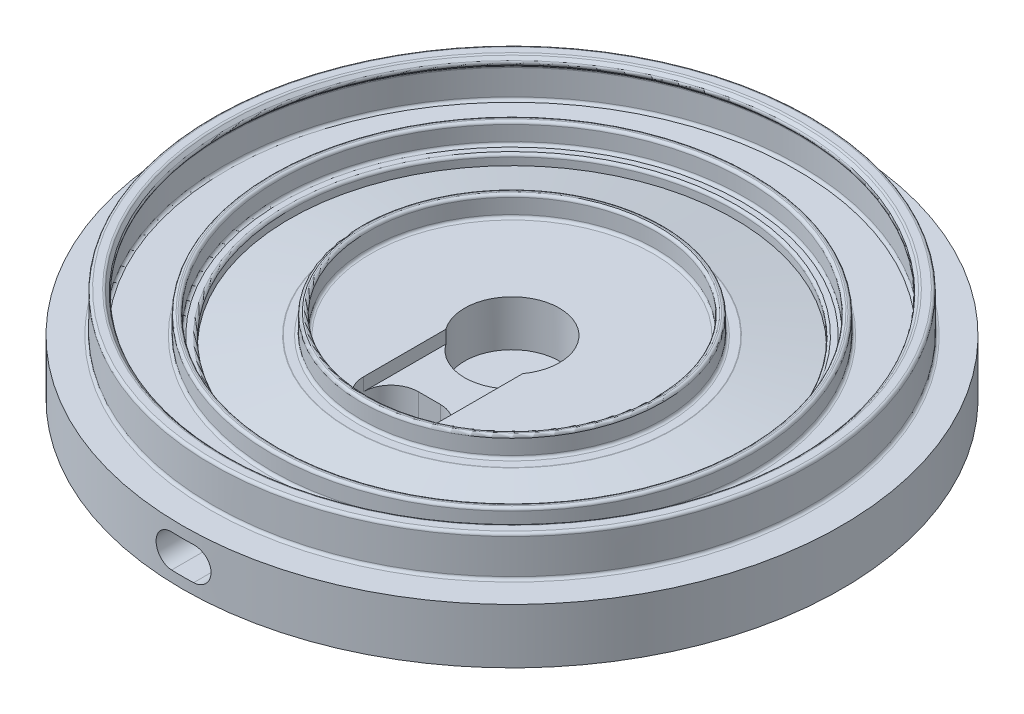
from build123d import *

# Parameters (mm, degrees)
SKETCH1_R               = 60
BOSS_EXTRUDE1_DEPTH     = 10
SKETCH3_R               = 43.75
SKETCH3_R_2             = 42.5
SKETCH3_R_3             = 27.5
SKETCH3_R_4             = 26.25
BOSS_EXTRUDE2_DEPTH     = 3.723
FILLET1_R               = 0.5
FILLET2_R               = 0.5
SKETCH6_R               = 8.625
CUT_EXTRUDE1_DEPTH      = 8.354
SKETCH9_W               = 14
SKETCH9_H               = 15
CUT_EXTRUDE2_DEPTH      = 2.354
CUT_EXTRUDE3_DEPTH      = 10
CUT_EXTRUDE4_DEPTH      = 2
CUT_EXTRUDE4_DEPTH_BACK = 40


with BuildPart() as part:
    # Sketch1 → Boss-Extrude1 (new body)
    with BuildSketch(Plane(origin=(0, 0, 0), x_dir=(1, 0, 0), z_dir=(0, 1, 0))):
        with Locations(Location((0, 0, 0), (0, 0, 270))):
            Circle(SKETCH1_R)
    extrude(amount=BOSS_EXTRUDE1_DEPTH)

    # Sketch2 → Cut-Revolve1 (revolve, cut)
    with BuildSketch(Plane.XY, mode=Mode.PRIVATE) as cut_revolve1_sk:
        Polygon((-29.5, 10), (-40.5, 8.127), (-40.5, 10), align=None)
    revolve(cut_revolve1_sk.sketch.rotate(Axis((0, 10, 0), (0, -1, 0)), 270), axis=Axis((0, 10, 0), (0, -1, 0)), mode=Mode.SUBTRACT)

    # Sketch3 → Boss-Extrude2 (add)
    # profile 1 of 2: a face of its own
    with BuildSketch(Plane(origin=(0, 10, 0), x_dir=(1, 0, 0), z_dir=(0, 1, 0))):
        with Locations(Location((0, 0, 0), (0, 0, 270))):
            Circle(SKETCH3_R)
        with Locations(Location((0, 0, 0), (0, 0, 270))):
            Circle(SKETCH3_R_2, mode=Mode.SUBTRACT)
    # profile 2 of 2: a face of its own
    with BuildSketch(Plane(origin=(0, 10, 0), x_dir=(1, 0, 0), z_dir=(0, 1, 0))):
        with Locations(Location((0, 0, 0), (0, 0, 270))):
            Circle(SKETCH3_R_3)
        with Locations(Location((0, 0, 0), (0, 0, 270))):
            Circle(SKETCH3_R_4, mode=Mode.SUBTRACT)
    extrude(amount=BOSS_EXTRUDE2_DEPTH)

    # Fillet1
    fillet1_edges = [part.edges().sort_by_distance(p)[0] for p in [
        (0, 10, -27.5),
        (0, 13.723, -27.5),
        (0, 10, -26.25),
        (0, 13.723, -26.25),
        (0, 10, -43.75),
        (0, 13.723, -43.75),
        (0, 10, -42.5),
        (0, 13.723, -42.5),
        (0, 10, -40.5),
        (0, 10, -29.5),
    ]]
    fillet(fillet1_edges, radius=FILLET1_R)

    # Sketch5 → Revolve1 (revolve)
    with BuildSketch(Plane.XY, mode=Mode.PRIVATE) as revolve1_sk:
        Polygon((-52.5, 10), (-54.5, 10), (-54.5, 17.323), (-52.5, 17.323), (-51.5, 16.323), (-52.5, 15.323), align=None)
    revolve(revolve1_sk.sketch.rotate(Axis((0, 10, 0), (0, 1, 0)), 270), axis=Axis((0, 10, 0), (0, 1, 0)))

    # Fillet2
    fillet2_edges = [part.edges().sort_by_distance(p)[0] for p in [
        (0, 10, 52.5),
        (0, 10, 54.5),
        (0, 17.323, 54.5),
        (0, 17.323, 52.5),
        (0, 16.323, 51.5),
        (0, 15.323, 52.5),
    ]]
    fillet(fillet2_edges, radius=FILLET2_R)

    # Sketch6 → Cut-Extrude1 (cut)
    with BuildSketch(Plane(origin=(0, 10, 0), x_dir=(1, 0, 0), z_dir=(0, 1, 0))):
        with Locations(Location((0, 0, 0), (0, 0, 270))):
            Circle(SKETCH6_R)
    extrude(amount=-CUT_EXTRUDE1_DEPTH, mode=Mode.SUBTRACT)

    # Sketch9 → Cut-Extrude2 (cut)
    with BuildSketch(Plane(origin=(0, 10, 0), x_dir=(1, 0, 0), z_dir=(0, 1, 0))):
        with Locations((0, -12.538911093)):
            Rectangle(SKETCH9_W, SKETCH9_H)
    extrude(amount=-CUT_EXTRUDE2_DEPTH, mode=Mode.SUBTRACT)

    # Sketch10 → Cut-Extrude3 (cut)
    with BuildSketch(Plane(origin=(0, 10, 0), x_dir=(1, 0, 0), z_dir=(0, 1, 0))):
        with BuildLine():
            Line((2, -25.038911093), (-2, -25.038911093))
            ThreePointArc((-2, -25.038911093), (-7, -20.038911093), (-2, -15.038911093))
            Line((-2, -15.038911093), (2, -15.038911093))
            ThreePointArc((2, -15.038911093), (7, -20.038911093), (2, -25.038911093))
        make_face()
    extrude(amount=-CUT_EXTRUDE3_DEPTH, mode=Mode.SUBTRACT)

    # Sketch11 → Cut-Extrude4 (cut, two sides: drawn at the far end of the back side and taken through both)
    with BuildSketch(Plane(origin=(0, 0, 25.038911093), x_dir=(-1, 0, 0), z_dir=(0, 0, -1)).offset(-CUT_EXTRUDE4_DEPTH_BACK)):
        with BuildLine():
            Line((-2, 8), (2, 8))
            ThreePointArc((2, 8), (5, 5), (2, 2))
            Line((2, 2), (-2, 2))
            ThreePointArc((-2, 2), (-5, 5), (-2, 8))
        make_face()
    extrude(amount=CUT_EXTRUDE4_DEPTH + CUT_EXTRUDE4_DEPTH_BACK, mode=Mode.SUBTRACT)


solid = part.part
